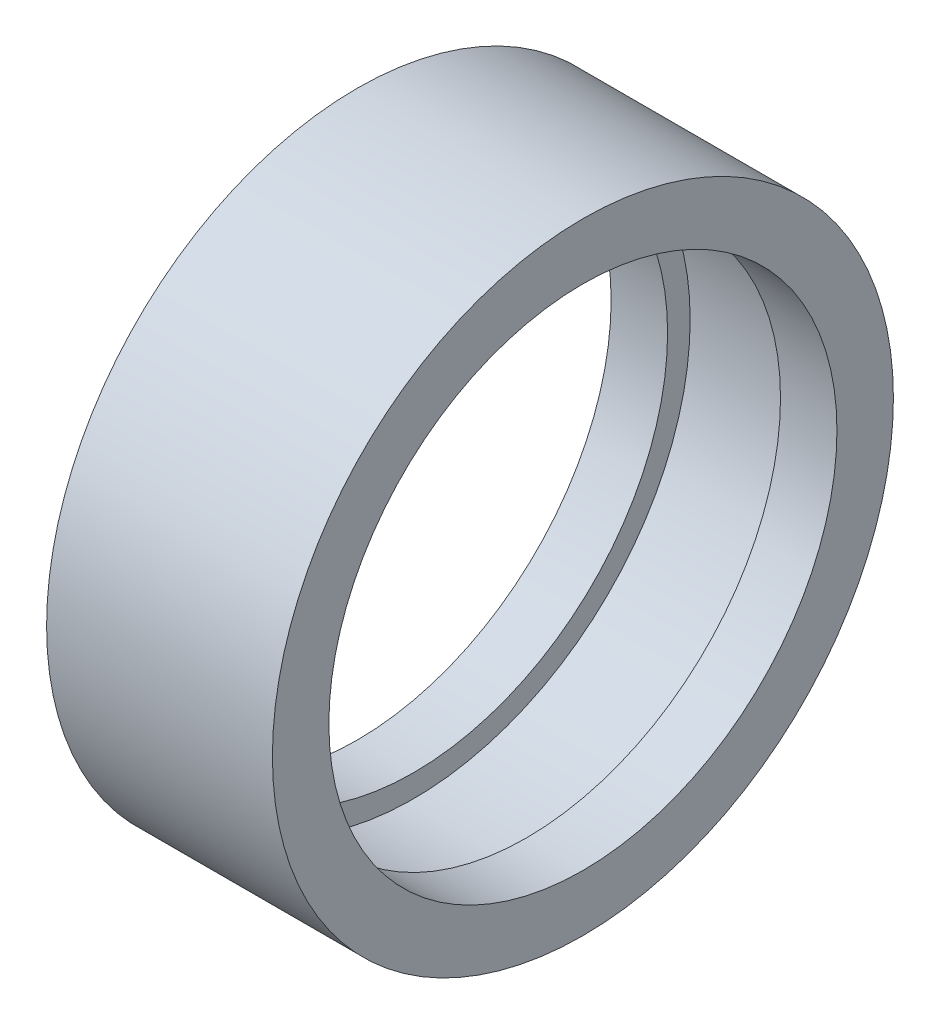
from build123d import *


with BuildPart() as part:
    # Sketch1 → Revolve1 (revolve)
    with BuildSketch(Plane.XY, mode=Mode.PRIVATE) as revolve1_sk:
        Polygon((-5.022421525, 11), (2.977578475, 11), (2.977578475, 9), (0.977578475, 9), (0.977578475, 9.8), (-3.022421525, 9.8), (-3.022421525, 9), (-5.022421525, 9), align=None)
    revolve(revolve1_sk.sketch.rotate(Axis((0, 0, 0), (-1, 0, 0)), 90), axis=Axis((0, 0, 0), (-1, 0, 0)))


solid = part.part
